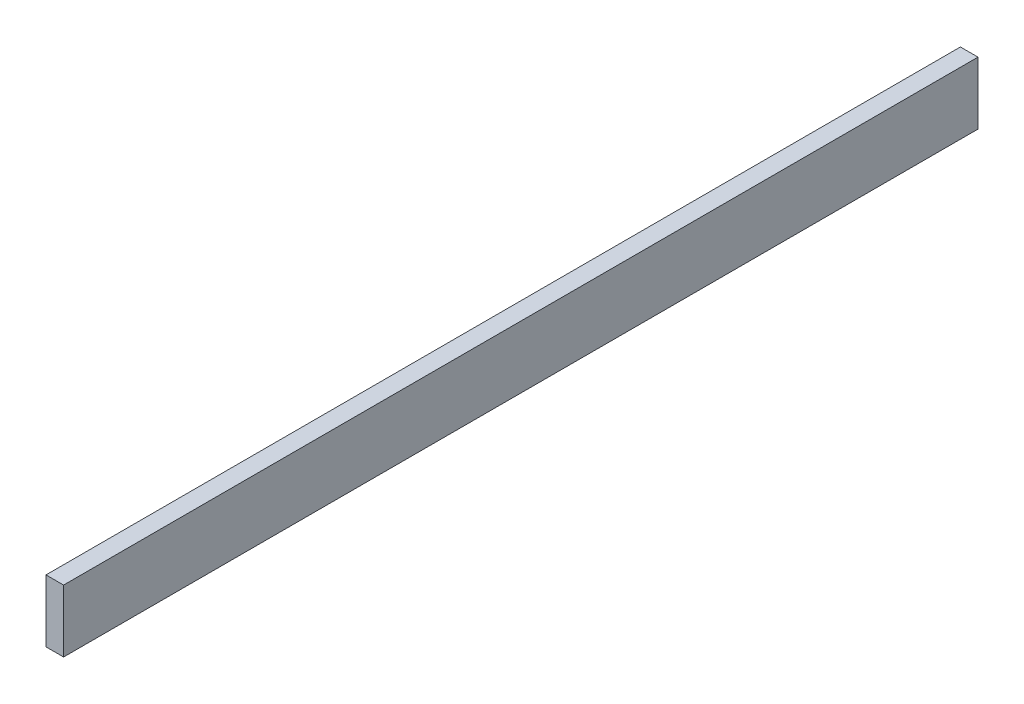
from build123d import *

# Parameters (mm, degrees)
SKETCH1_W                          = 12.7
SKETCH1_H                          = 45
CEK_TAZE_RAY_IC_PROFIL_SOL_1_DEPTH = 660


with BuildPart() as part:
    # Sketch1 → CEK_taze_ray_ic_profil_sol_1 (new body)
    with BuildSketch(Plane.XY):
        with Locations((6.35, 40.5)):
            Rectangle(SKETCH1_W, SKETCH1_H)
    extrude(amount=-CEK_TAZE_RAY_IC_PROFIL_SOL_1_DEPTH)


solid = part.part
